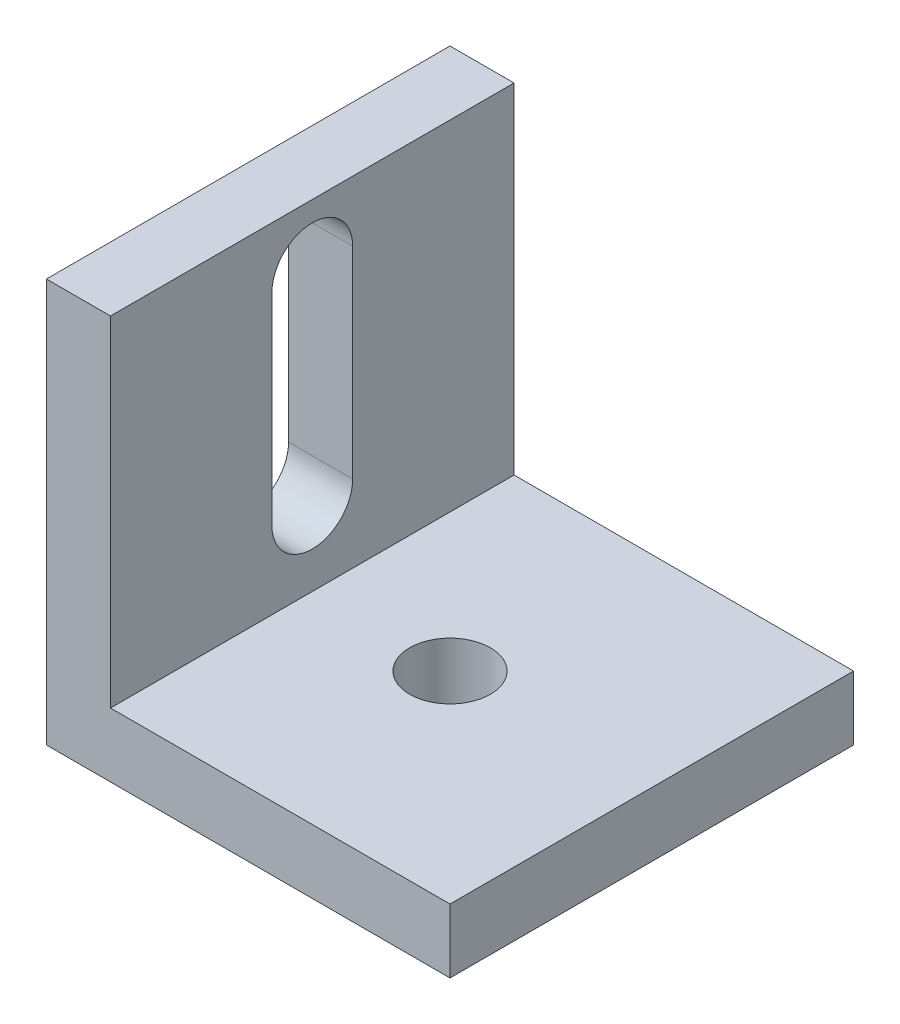
from build123d import *

# Parameters (mm, degrees)
BOSS_EXTRUDE1_DEPTH      = 10
BOSS_EXTRUDE1_DEPTH_BACK = 10
SKETCH2_R                = 2
CUT_EXTRUDE1_DEPTH       = 10
CUT_EXTRUDE2_DEPTH       = 10


with BuildPart() as part:
    # Sketch1 → Boss-Extrude1 (new, two sides: drawn at the far end of the back side and taken through both)
    with BuildSketch(Plane.XY.offset(-BOSS_EXTRUDE1_DEPTH_BACK)):
        Polygon((0, 0), (0, 16.825), (-3.175, 16.825), (-3.175, -3.175), (16.825, -3.175), (16.825, 0), align=None)
    extrude(amount=BOSS_EXTRUDE1_DEPTH + BOSS_EXTRUDE1_DEPTH_BACK)

    # Sketch2 → Cut-Extrude1 (cut)
    with BuildSketch(Plane(origin=(0, 0, 0), x_dir=(1, 0, 0), z_dir=(0, 1, 0))):
        with Locations((6.825, 0)):
            Circle(SKETCH2_R)
    extrude(amount=-CUT_EXTRUDE1_DEPTH, mode=Mode.SUBTRACT)

    # Sketch3 → Cut-Extrude2 (cut)
    with BuildSketch(Plane(origin=(0, 0, 0), x_dir=(0, 0, -1), z_dir=(1, 0, 0))):
        with BuildLine():
            Line((2, 13.825), (2, 3.825))
            ThreePointArc((2, 3.825), (0, 1.825), (-2, 3.825))
            Line((-2, 3.825), (-2, 13.825))
            ThreePointArc((-2, 13.825), (0, 15.825), (2, 13.825))
        make_face()
    extrude(amount=-CUT_EXTRUDE2_DEPTH, mode=Mode.SUBTRACT)


solid = part.part
